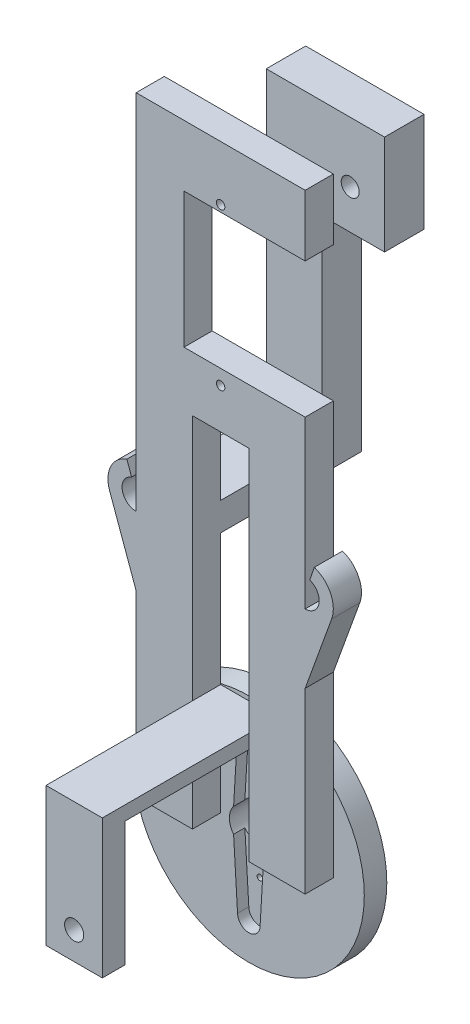
from build123d import *

# Parameters (mm, degrees)
SKETCH2_R           = 20.5
BOSS_EXTRUDE1_DEPTH = 4
BOSS_EXTRUDE2_START = -2
BOSS_EXTRUDE2_DEPTH = 2
SKETCH4_R           = 0.75
SKETCH4_W           = 13
SKETCH4_H           = 24
BOSS_EXTRUDE3_DEPTH = 5
SKETCH5_W           = 10
SKETCH5_H           = 5
BOSS_EXTRUDE4_DEPTH = 25
SKETCH6_W           = 21
SKETCH6_H           = 7
BOSS_EXTRUDE5_DEPTH = 52.4
SKETCH7_R           = 1.6
CUT_EXTRUDE1_DEPTH  = 52.4
SKETCH8_R           = 0.500000007
CUT_EXTRUDE2_DEPTH  = 10
SKETCH9_W           = 8.5
SKETCH9_H           = 24
CUT_EXTRUDE3_DEPTH  = 10
SKETCH10_W          = 10
SKETCH10_H          = 2.505647768
BOSS_EXTRUDE6_DEPTH = 31
SKETCH11_W          = 10
SKETCH11_H          = 24.604481137
SKETCH11_R          = 1.7
BOSS_EXTRUDE7_DEPTH = 4
BOSS_EXTRUDE8_DEPTH = 5
SKETCH13_W          = 11.098107646
SKETCH13_H          = 34.722384721
CUT_EXTRUDE4_DEPTH  = 10


with BuildPart() as part:
    # Sketch2 → Boss-Extrude1 (new body)
    with BuildSketch(Plane.XY):
        with Locations((-30.000000447, 0)):
            Circle(SKETCH2_R)
        with BuildLine():
            Line((-32.000000447, -13.925), (-32.700000447, -2.147673159))
            ThreePointArc((-32.700000447, -2.147673159), (-33.450000447, 0), (-32.700000447, 2.147673159))
            Line((-32.700000447, 2.147673159), (-32.000000447, 13.925))
            ThreePointArc((-32.000000447, 13.925), (-30.000000447, 15.925), (-28.000000447, 13.925))
            Line((-28.000000447, 13.925), (-27.300000447, 2.147673159))
            ThreePointArc((-27.300000447, 2.147673159), (-26.550000447, 0), (-27.300000447, -2.147673159))
            Line((-27.300000447, -2.147673159), (-28.000000447, -13.925))
            ThreePointArc((-28.000000447, -13.925), (-30.000000447, -15.925), (-32.000000447, -13.925))
        make_face(mode=Mode.SUBTRACT)
    extrude(amount=-BOSS_EXTRUDE1_DEPTH)

    # Sketch3 → Boss-Extrude2 (add)
    with BuildSketch(Plane(origin=(0, 0, -4), x_dir=(-1, 0, 0), z_dir=(0, 0, -1)).offset(BOSS_EXTRUDE2_START)):
        with BuildLine():
            Line((32.000000447, 13.925), (32.700000447, 2.147673159))
            ThreePointArc((32.700000447, 2.147673159), (30.000000278, 3.45000035), (27.300000447, 2.147673159))
            Line((27.300000447, 2.147673159), (28.000000447, 13.925))
            ThreePointArc((28.000000447, 13.925), (30.000000447, 15.925), (32.000000447, 13.925))
        make_face()
        with BuildLine():
            Line((32.700000447, -2.147673159), (32.000000447, -13.925))
            ThreePointArc((32.000000447, -13.925), (30.000000447, -15.925), (28.000000447, -13.925))
            Line((28.000000447, -13.925), (27.300000447, -2.147673159))
            ThreePointArc((27.300000447, -2.147673159), (30.000000278, -3.44999965), (32.700000447, -2.147673159))
        make_face()
    extrude(amount=BOSS_EXTRUDE2_DEPTH)

    # Sketch4 → Boss-Extrude3 (add)
    with BuildSketch(Plane.XY):
        Polygon((-45.000000447, 0), (-35.000000447, 0), (-35.000000447, 63.556554203), (-25.000000447, 63.556554203), (-25.000000447, 0), (-15.000000447, 0), (-15.000000447, 66.480727098), (-15.000000447, 108.20577925), (-45.000000447, 108.20577925), (-45.000000447, 66.480727098), align=None)
        with Locations((-30.000000447, 70.680727098)):
            Circle(SKETCH4_R, mode=Mode.SUBTRACT)
        with Locations((-30.000000447, 98.480727098)):
            Circle(SKETCH4_R, mode=Mode.SUBTRACT)
        with Locations((-30.000000447, 85.330727098)):
            Rectangle(SKETCH4_W, SKETCH4_H, mode=Mode.SUBTRACT)
    extrude(amount=BOSS_EXTRUDE3_DEPTH)

    # Sketch5 → Boss-Extrude4 (add)
    with BuildSketch(Plane(origin=(0, 0, 0), x_dir=(-1, 0, 0), z_dir=(0, 0, -1))):
        with Locations((40.000000447, 45.531062225)):
            Rectangle(SKETCH5_W, SKETCH5_H)
    extrude(amount=BOSS_EXTRUDE4_DEPTH)

    # Sketch6 → Boss-Extrude5 (add)
    with BuildSketch(Plane(origin=(0, 48.031062225, 0), x_dir=(1, 0, 0), z_dir=(0, 1, 0))):
        with Locations((-34.401892801, 21.5)):
            Rectangle(SKETCH6_W, SKETCH6_H)
    extrude(amount=BOSS_EXTRUDE5_DEPTH)

    # Sketch7 → Cut-Extrude1 (cut)
    with BuildSketch(Plane(origin=(0, 0, -25), x_dir=(-1, 0, 0), z_dir=(0, 0, -1))):
        with Locations((30.000000447, 89.730727098)):
            Circle(SKETCH7_R)
    extrude(amount=-CUT_EXTRUDE1_DEPTH, mode=Mode.SUBTRACT)

    # Sketch8 → Cut-Extrude2 (cut)
    with BuildSketch(Plane.XY):
        with Locations((-29.975317233, 10.434970799)):
            Circle(SKETCH8_R)
        with Locations((-30.020023773, -8.464976311)):
            Circle(SKETCH8_R)
    extrude(amount=-CUT_EXTRUDE2_DEPTH, mode=Mode.SUBTRACT)

    # Sketch9 → Cut-Extrude3 (cut)
    with BuildSketch(Plane.XY.offset(5)):
        with Locations((-19.250000447, 85.330727098)):
            Rectangle(SKETCH9_W, SKETCH9_H)
    extrude(amount=-CUT_EXTRUDE3_DEPTH, mode=Mode.SUBTRACT)

    # Sketch10 → Boss-Extrude6 (add)
    with BuildSketch(Plane.XY):
        with Locations((-30.000000447, 18.464419485)):
            Rectangle(SKETCH10_W, SKETCH10_H)
    extrude(amount=BOSS_EXTRUDE6_DEPTH)

    # Sketch11 → Boss-Extrude7 (add)
    with BuildSketch(Plane.XY.offset(31)):
        with Locations((-30.000000447, 7.415002801)):
            Rectangle(SKETCH11_W, SKETCH11_H)
        with Locations((-30.000000447, 0)):
            Circle(SKETCH11_R, mode=Mode.SUBTRACT)
    extrude(amount=-BOSS_EXTRUDE7_DEPTH)

    # Sketch12 → Boss-Extrude8 (add)
    with BuildSketch(Plane.XY.offset(5)):
        with BuildLine():
            Line((-14.181307682, 48.701973767), (-13.362614918, 51.064121552))
            ThreePointArc((-13.362614918, 51.064121552), (-10.487154092, 48.492549322), (-10.297966628, 44.639567777))
            Line((-10.297966628, 44.639567777), (-15.000000447, 31.636176901))
            Line((-15.000000447, 31.636176901), (-15.000000447, 43.839825982))
            ThreePointArc((-15.000000447, 43.839825982), (-12.534704373, 45.924717238), (-14.181307682, 48.701973767))
        make_face()
        with BuildLine():
            Line((-49.702034266, 44.639567777), (-45.000000447, 31.636176901))
            Line((-45.000000447, 31.636176901), (-45.000000447, 43.839825982))
            ThreePointArc((-45.000000447, 43.839825982), (-47.465296521, 45.924717238), (-45.818693212, 48.701973767))
            Line((-45.818693212, 48.701973767), (-46.637385976, 51.064121552))
            ThreePointArc((-46.637385976, 51.064121552), (-49.512846802, 48.492549322), (-49.702034266, 44.639567777))
        make_face()
    extrude(amount=-BOSS_EXTRUDE8_DEPTH)

    # Sketch13 → Cut-Extrude4 (cut)
    with BuildSketch(Plane(origin=(0, 0, -25), x_dir=(-1, 0, 0), z_dir=(0, 0, -1))):
        with Locations((29.450946624, 65.392254586)):
            Rectangle(SKETCH13_W, SKETCH13_H)
    extrude(amount=-CUT_EXTRUDE4_DEPTH, mode=Mode.SUBTRACT)


solid = part.part
